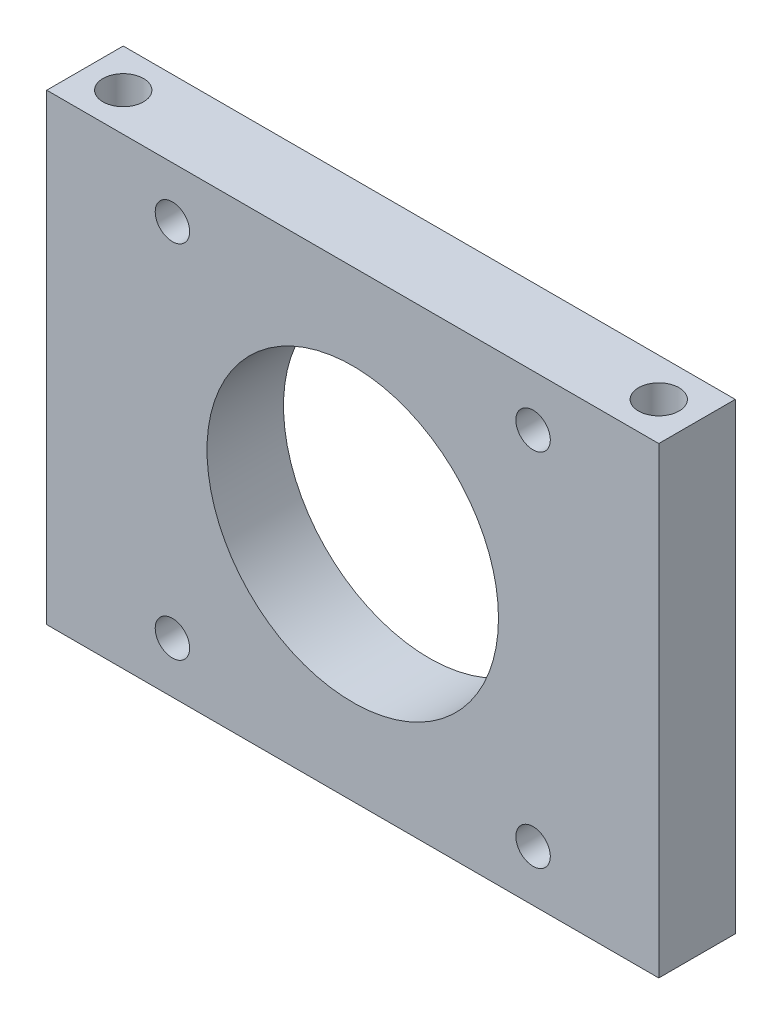
from build123d import *

# Parameters (mm, degrees)
SKETCH_1_W          = 80
SKETCH_1_H          = 60.5
EXTRUDE_1_DEPTH     = 5
SKETCH_3_R          = 19.05
CUT_EXTRUDE_1_DEPTH = 52.137681801
HOLE_WIZARD_M4_1_D  = 4.5
HOLE_WIZARD_M5_1_D  = 5.3


with BuildPart() as part:
    # 草圖1 → 填料-伸長1 (new, symmetric)
    with BuildSketch(Plane.XY):
        Rectangle(SKETCH_1_W, SKETCH_1_H)
    extrude(amount=EXTRUDE_1_DEPTH, both=True)

    # 草圖3 → 除料-伸長1 (cut, through all)
    with BuildSketch(Plane.XY.offset(5)):
        Circle(SKETCH_3_R)
    extrude(amount=-CUT_EXTRUDE_1_DEPTH, mode=Mode.SUBTRACT)

    # M4 餘隙孔1 (through all)
    with Locations(Plane(origin=(0, 0, -5), x_dir=(-1, 0, 0), z_dir=(0, 0, -1))):
        with Locations((23.57, 23.57), (-23.57, -23.57), (-23.57, 23.57), (23.57, -23.57)):
            Hole(HOLE_WIZARD_M4_1_D / 2)

    # M5 餘隙孔1 (through all)
    with Locations(Plane(origin=(0, 30.25, 0), x_dir=(1, 0, 0), z_dir=(0, 1, 0))):
        with Locations((-35, 0), (35, 0)):
            Hole(HOLE_WIZARD_M5_1_D / 2)


solid = part.part
